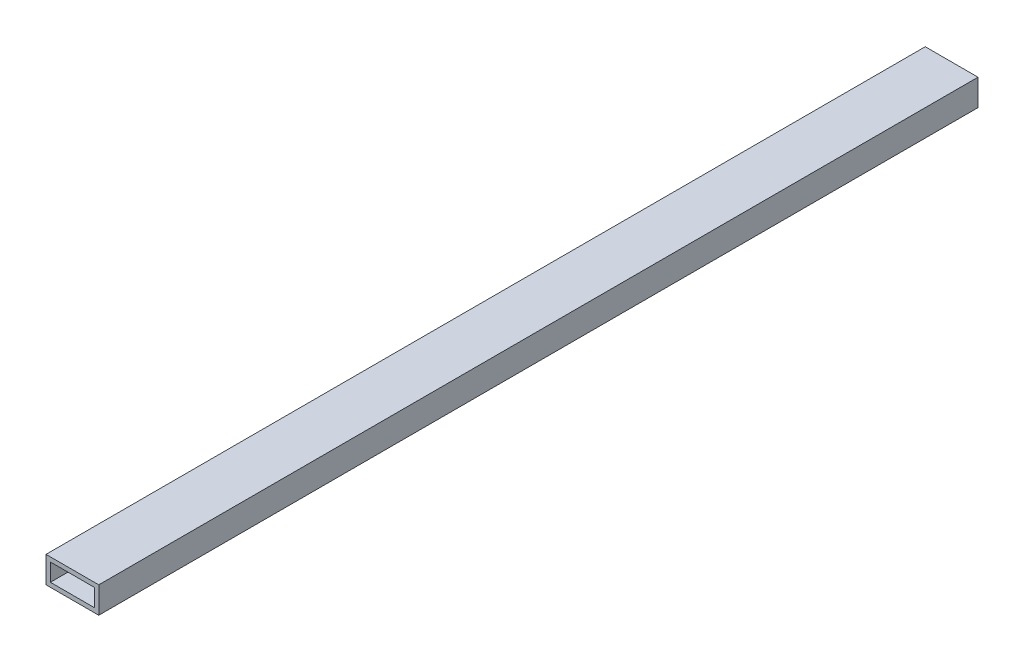
from build123d import *

# Parameters (mm, degrees)
BOSS_EXTRUDE1_DEPTH      = 317.5
BOSS_EXTRUDE1_DEPTH_BACK = 317.5
SKETCH3_W                = 38.1
SKETCH3_H                = 19.05
SKETCH3_W_2              = 31.75
SKETCH3_H_2              = 12.7


with BuildPart() as part:
    # Sketch3 → Boss-Extrude1 (new, two sides: drawn at the far end of the back side and taken through both)
    with BuildSketch(Plane.XY.offset(-BOSS_EXTRUDE1_DEPTH_BACK)):
        Rectangle(SKETCH3_W, SKETCH3_H)
        Rectangle(SKETCH3_W_2, SKETCH3_H_2, mode=Mode.SUBTRACT)
    extrude(amount=BOSS_EXTRUDE1_DEPTH + BOSS_EXTRUDE1_DEPTH_BACK)


solid = part.part
